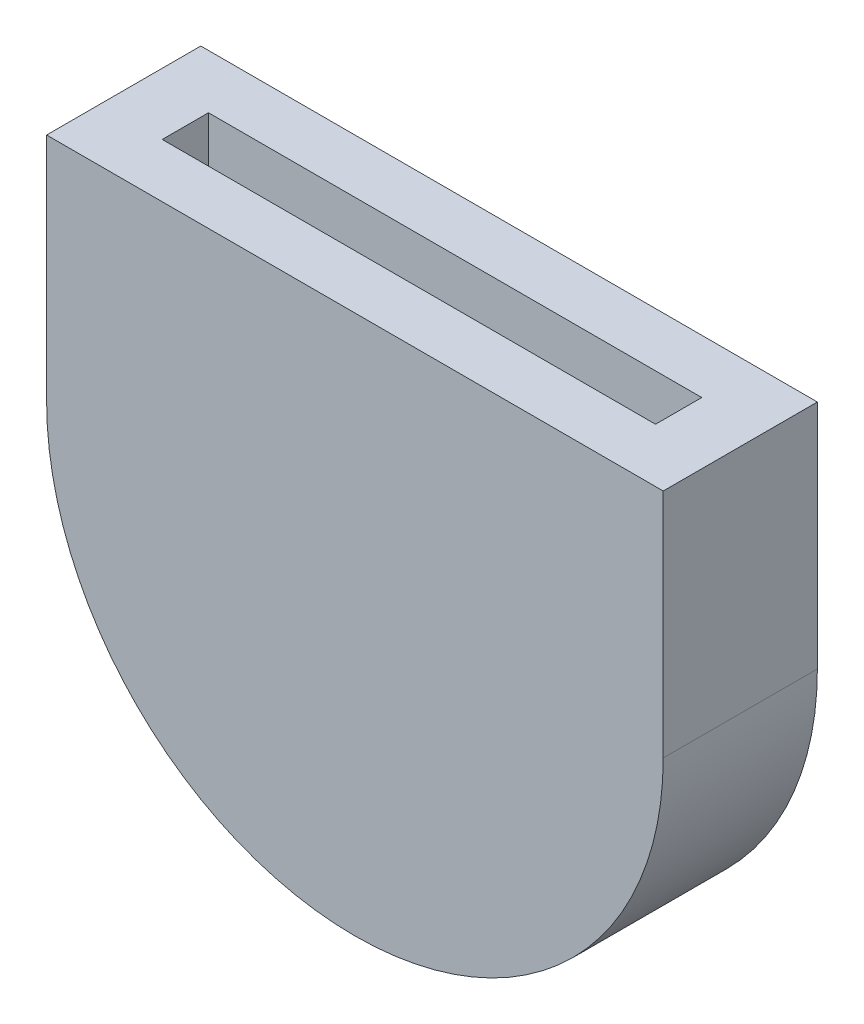
from build123d import *

# Parameters (mm, degrees)
EXTRUDE_1_DEPTH     = 5
CUT_EXTRUDE_2_DEPTH = 1.5


with BuildPart() as part:
    # 草图1 → 凸台-拉伸1 (new, symmetric)
    with BuildSketch(Plane.XY):
        with BuildLine():
            Line((-20, 0), (-20, 15))
            Line((-20, 15), (20, 15))
            Line((20, 15), (20, 0))
            ThreePointArc((20, 0), (0, -20), (-20, 0))
        make_face()
    extrude(amount=EXTRUDE_1_DEPTH, both=True)

    # 草图2 → 切除-拉伸2 (cut, symmetric)
    with BuildSketch(Plane.XY):
        with BuildLine():
            Line((-16, 0), (-16, 15))
            Line((-16, 15), (16, 15))
            Line((16, 15), (16, 0))
            ThreePointArc((16, 0), (0, -16), (-16, 0))
        make_face()
    extrude(amount=CUT_EXTRUDE_2_DEPTH, both=True, mode=Mode.SUBTRACT)


solid = part.part
